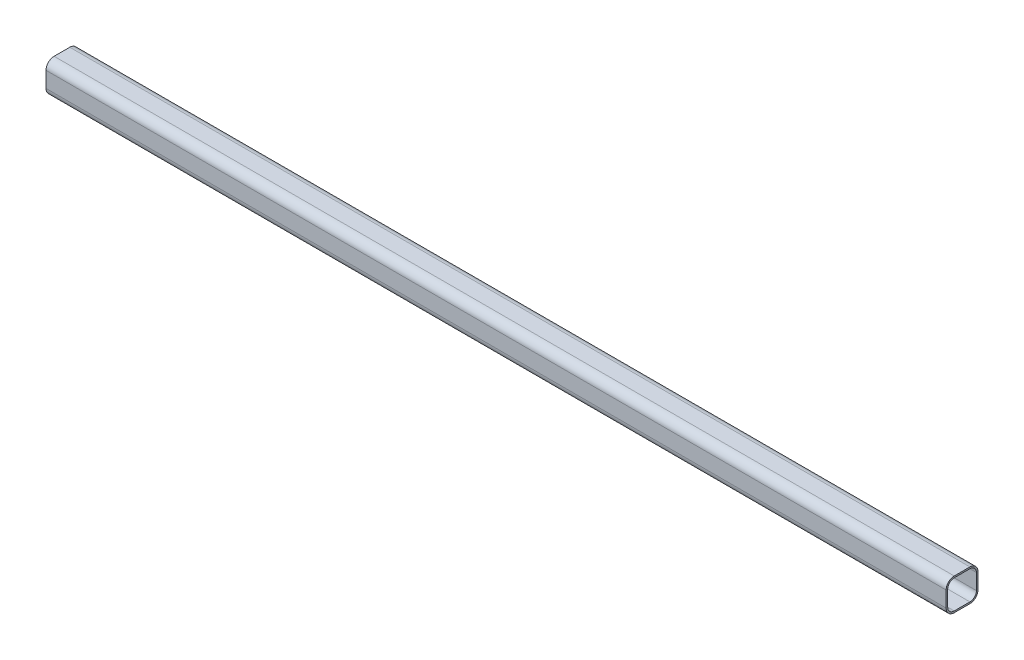
from build123d import *

# Parameters (mm, degrees)
MIEMBRO_ESTRUCTURAL1_DEPTH        = 1412
TALADRO_DE_MARGEN_PARA_M161_D     = 17.5
TALADRO_DE_MARGEN_PARA_M161_DEPTH = 2.5


with BuildPart() as part:
    # Sketch1 → Miembro estructural1 (new body)
    with BuildSketch(Plane.YZ.offset(-623.635182539)):
        with BuildLine():
            Line((-12.3, -25), (12.3, -25))
            ThreePointArc((12.3, -25), (21.280256121, -21.280256121), (25, -12.3))
            Line((25, -12.3), (25, 12.3))
            ThreePointArc((25, 12.3), (21.280256121, 21.280256121), (12.3, 25))
            Line((12.3, 25), (-12.3, 25))
            ThreePointArc((-12.3, 25), (-21.280256121, 21.280256121), (-25, 12.3))
            Line((-25, 12.3), (-25, -12.3))
            ThreePointArc((-25, -12.3), (-21.280256121, -21.280256121), (-12.3, -25))
        make_face()
        with BuildLine():
            Line((-12.3, -22.5), (12.3, -22.5))
            ThreePointArc((12.3, -22.5), (19.512489168, -19.512489168), (22.5, -12.3))
            Line((22.5, -12.3), (22.5, 12.3))
            ThreePointArc((22.5, 12.3), (19.512489168, 19.512489168), (12.3, 22.5))
            Line((12.3, 22.5), (-12.3, 22.5))
            ThreePointArc((-12.3, 22.5), (-19.512489168, 19.512489168), (-22.5, 12.3))
            Line((-22.5, 12.3), (-22.5, -12.3))
            ThreePointArc((-22.5, -12.3), (-19.512489168, -19.512489168), (-12.3, -22.5))
        make_face(mode=Mode.SUBTRACT)
    extrude(amount=MIEMBRO_ESTRUCTURAL1_DEPTH)

    # Taladro de margen para M161
    with Locations(Plane(origin=(0, -25, 0), x_dir=(-1, 0, 0), z_dir=(0, -1, 0))):
        with Locations((-152.364817461, 0), (-212.364817461, 0)):
            Hole(TALADRO_DE_MARGEN_PARA_M161_D / 2, depth=TALADRO_DE_MARGEN_PARA_M161_DEPTH)


solid = part.part
